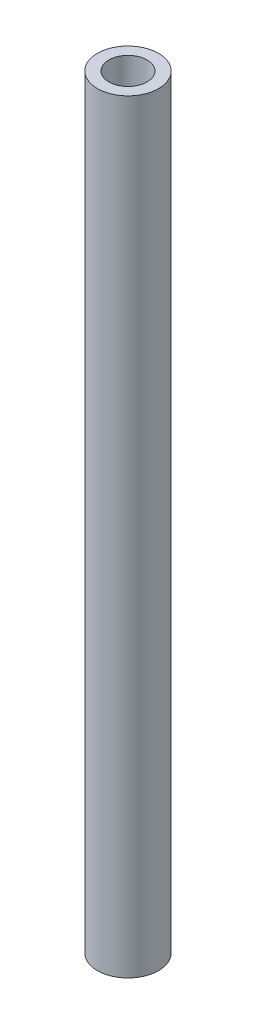
from build123d import *

# Parameters (mm, degrees)
SKETCH1_R           = 4
SKETCH1_R_2         = 2.5
BOSS_EXTRUDE1_DEPTH = 100


with BuildPart() as part:
    # Sketch1 → Boss-Extrude1 (new body)
    with BuildSketch(Plane(origin=(0, 0, 0), x_dir=(1, 0, 0), z_dir=(0, 1, 0))):
        with Locations(Location((0, 0, 0), (0, 0, 270))):
            Circle(SKETCH1_R)
        with Locations(Location((0, 0, 0), (0, 0, 270))):
            Circle(SKETCH1_R_2, mode=Mode.SUBTRACT)
    extrude(amount=BOSS_EXTRUDE1_DEPTH)


solid = part.part
